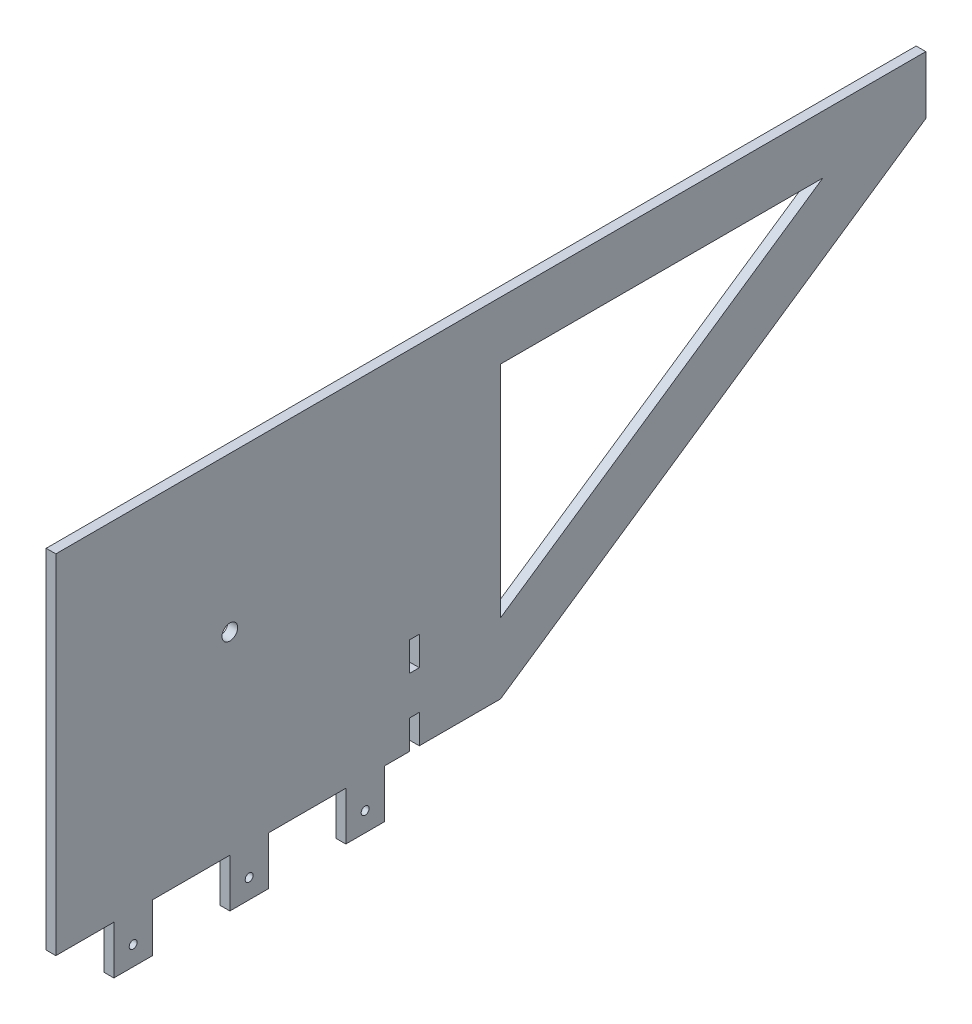
from build123d import *

# Parameters (mm, degrees)
SKETCH_1_R          = 2.05
EXTRUDE_1_DEPTH     = 5
SKETCH_2_R          = 4.05
CUT_EXTRUDE_1_DEPTH = 10
SKETCH_3_W          = 5
SKETCH_3_H          = 15
CUT_EXTRUDE_2_DEPTH = 153.47950682
EXTRUDE_2_DEPTH     = 5


with BuildPart() as part:
    # 草圖1 → 填料-伸長1 (new body)
    with BuildSketch(Plane(origin=(0, 0, 0), x_dir=(0, 0, -1), z_dir=(1, 0, 0))):
        Polygon((-70, -90), (-100, -90), (-100, 90), (100, 90), (100, -90), (70, -90), (70, -115), (50, -115), (50, -90), (10, -90), (10, -115), (-10, -115), (-10, -90), (-50, -90), (-50, -115), (-70, -115), align=None)
        with Locations((-60, -105)):
            Circle(SKETCH_1_R, mode=Mode.SUBTRACT)
        with Locations((0, -105)):
            Circle(SKETCH_1_R, mode=Mode.SUBTRACT)
        with Locations((60, -105)):
            Circle(SKETCH_1_R, mode=Mode.SUBTRACT)
    extrude(amount=EXTRUDE_1_DEPTH)

    # 草圖2 → 除料-伸長1 (cut)
    with BuildSketch(Plane(origin=(5, 0, 0), x_dir=(0, 0, -1), z_dir=(1, 0, 0))):
        with Locations((-10, 10)):
            Circle(SKETCH_2_R)
    extrude(amount=-CUT_EXTRUDE_1_DEPTH, mode=Mode.SUBTRACT)

    # 草圖3 → 除料-伸長2 (cut, through all)
    with BuildSketch(Plane(origin=(5, 0, 0), x_dir=(0, 0, -1), z_dir=(1, 0, 0))):
        with Locations((85.5, -47.5)):
            Rectangle(SKETCH_3_W, SKETCH_3_H)
        with Locations((85.5, -82.5)):
            Rectangle(SKETCH_3_W, SKETCH_3_H)
    extrude(amount=-CUT_EXTRUDE_2_DEPTH, mode=Mode.SUBTRACT)

    # 草圖4 → 填料-伸長2 (add)
    with BuildSketch(Plane.ZY):
        Polygon((-100, 90), (-350, 90), (-350, 60), (-130, -90), (-100, -90), align=None)
        Polygon((-130, 60), (-130, -53.69038103), (-296.745892177, 60), align=None, mode=Mode.SUBTRACT)
    extrude(amount=-EXTRUDE_2_DEPTH)


solid = part.part
